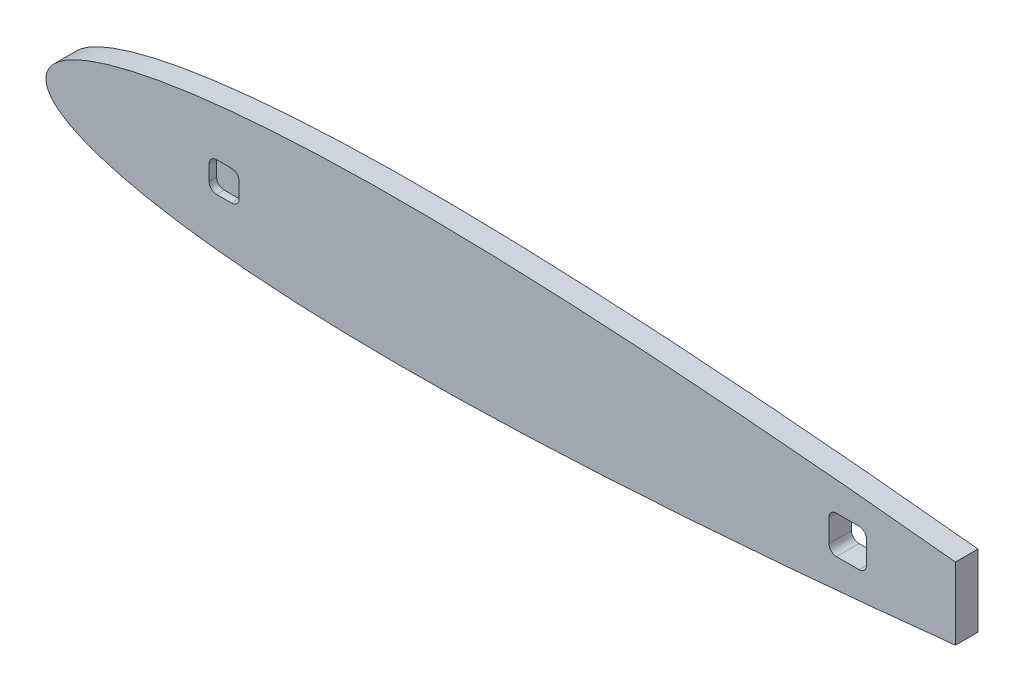
from build123d import *

# Parameters (mm, degrees)
RESSALTO_EXTRUS_O1_DEPTH = 6
CORTE_EXTRUS_O1_DEPTH    = 2


with BuildPart() as part:
    # Esboço2 → Ressalto-extrusão1 (new body)
    with BuildSketch(Plane.XY):
        with BuildLine():
            Line((242, -9.589142856), (242, 9.589142856))
            add(Edge.make_bspline(
                [(242, 9.589142856), (239.881252566, 9.813363987), (235.500866993, 10.270786744), (228.8033041, 10.952622095), (221.858798663, 11.63824546), (214.766562031, 12.317065717), (207.543063709, 12.984368151), (200.205154302, 13.637971107), (192.770016736, 14.272471351), (185.254977834, 14.88503078), (177.677684334, 15.471737584), (170.055736643, 16.027881886), (162.40704666, 16.549975637), (154.749469182, 17.033848442), (147.100729109, 17.474827228), (139.478832183, 17.869424682), (131.901405659, 18.213332959), (124.386208897, 18.502720934), (116.950906263, 18.734375885), (109.612808746, 18.904177161), (102.389047686, 19.009131312), (95.296318699, 19.046288449), (88.351326253, 19.013440651), (81.57032427, 18.909111024), (74.969202801, 18.730146674), (68.563231899, 18.477339509), (62.367359064, 18.148873086), (56.39600907, 17.745668031), (50.663243104, 17.267808413), (45.18238949, 16.71616277), (39.966183181, 16.092823711), (35.026649567, 15.400324993), (30.37542502, 14.639957437), (26.023169264, 13.815521264), (21.979898941, 12.930116494), (18.255063513, 11.986744519), (14.856893697, 10.989631519), (11.79288245, 9.942088903), (9.069563952, 8.847734633), (6.692329129, 7.709725732), (4.665706927, 6.530431468), (2.99205726, 5.311850985), (1.674614077, 4.05197978), (0.716554427, 2.74724885), (0.130795245, 1.391280824), (-0.063755079, 0), (0.130795245, -1.391280824), (0.716554427, -2.74724885), (1.674614077, -4.05197978), (2.99205726, -5.311850985), (4.665706927, -6.530431468), (6.692329129, -7.709725732), (9.069563952, -8.847734633), (11.79288245, -9.942088903), (14.856893697, -10.989631519), (18.255063513, -11.986744519), (21.979898941, -12.930116494), (26.023169264, -13.815521264), (30.37542502, -14.639957437), (35.026649567, -15.400324993), (39.966183181, -16.092823711), (45.18238949, -16.71616277), (50.663243104, -17.267808413), (56.39600907, -17.745668031), (62.367359064, -18.148873086), (68.563231899, -18.477339509), (74.969202801, -18.730146674), (81.57032427, -18.909111024), (88.351326253, -19.013440651), (95.296318699, -19.046288449), (102.389047686, -19.009131312), (109.612808746, -18.904177161), (116.950906263, -18.734375885), (124.386208897, -18.502720934), (131.901405659, -18.213332959), (139.478832183, -17.869424682), (147.100729109, -17.474827228), (154.749469182, -17.033848442), (162.40704666, -16.549975637), (170.055736643, -16.027881886), (177.677684334, -15.471737584), (185.254977834, -14.88503078), (192.770016736, -14.272471351), (200.205154302, -13.637971107), (207.543063709, -12.984368151), (214.766562031, -12.317065717), (221.858798663, -11.63824546), (228.8033041, -10.952622095), (235.500866993, -10.270786744), (239.881252566, -9.813363987), (242, -9.589142856)],
                knots=[0.120450629, 0.120450629, 0.120450629, 0.120450629, 0.130246743, 0.140700547, 0.151404252, 0.162331842, 0.173458675, 0.18475829, 0.196204076, 0.207768618, 0.219425945, 0.231147635, 0.242906359, 0.254675296, 0.26642621, 0.278132455, 0.289766477, 0.301301814, 0.312711646, 0.323969259, 0.33505005, 0.345928599, 0.356580621, 0.366981996, 0.377109776, 0.386942119, 0.396457905, 0.405636645, 0.41445907, 0.42290662, 0.430962851, 0.438611618, 0.445838275, 0.452630377, 0.458976173, 0.4648663, 0.470293868, 0.475254829, 0.479749124, 0.483781006, 0.48736258, 0.490515632, 0.493278566, 0.495712194, 0.497909944, 0.5, 0.502090056, 0.504287806, 0.506721434, 0.509484368, 0.51263742, 0.516218994, 0.520250876, 0.524745171, 0.529706132, 0.5351337, 0.541023827, 0.547369623, 0.554161725, 0.561388382, 0.569037149, 0.57709338, 0.58554093, 0.594363355, 0.603542095, 0.613057881, 0.622890224, 0.633018004, 0.643419379, 0.654071401, 0.66494995, 0.676030741, 0.687288354, 0.698698186, 0.710233523, 0.721867545, 0.73357379, 0.745324704, 0.757093641, 0.768852365, 0.780574055, 0.792231382, 0.803795924, 0.81524171, 0.826541325, 0.837668158, 0.848595748, 0.859299453, 0.869753257, 0.879549371, 0.879549371, 0.879549371, 0.879549371], degree=3))
        make_face()
        with BuildLine():
            Line((216.33333333, -5), (210.33333333, -5))
            ThreePointArc((210.33333333, -5), (208.919119768, -4.414213562), (208.33333333, -3))
            Line((208.33333333, -3), (208.33333333, 3))
            ThreePointArc((208.33333333, 3), (208.919119768, 4.414213562), (210.33333333, 5))
            Line((210.33333333, 5), (216.33333333, 5))
            ThreePointArc((216.33333333, 5), (217.747546892, 4.414213562), (218.33333333, 3))
            Line((218.33333333, 3), (218.33333333, -3))
            ThreePointArc((218.33333333, -3), (217.747546892, -4.414213562), (216.33333333, -5))
        make_face(mode=Mode.SUBTRACT)
    extrude(amount=RESSALTO_EXTRUS_O1_DEPTH)

    # Esboço3 → Corte-extrusão1 (cut)
    with BuildSketch(Plane.XY.offset(6)):
        with BuildLine():
            Line((45.4, -4), (49.4, -4))
            ThreePointArc((49.4, -4), (50.814213562, -3.414213562), (51.4, -2))
            Line((51.4, -2), (51.4, 2))
            ThreePointArc((51.4, 2), (50.814213562, 3.414213562), (49.4, 4))
            Line((49.4, 4), (45.4, 4))
            ThreePointArc((45.4, 4), (43.985786438, 3.414213562), (43.4, 2))
            Line((43.4, 2), (43.4, -2))
            ThreePointArc((43.4, -2), (43.985786438, -3.414213562), (45.4, -4))
        make_face()
    extrude(amount=-CORTE_EXTRUS_O1_DEPTH, mode=Mode.SUBTRACT)


solid = part.part
